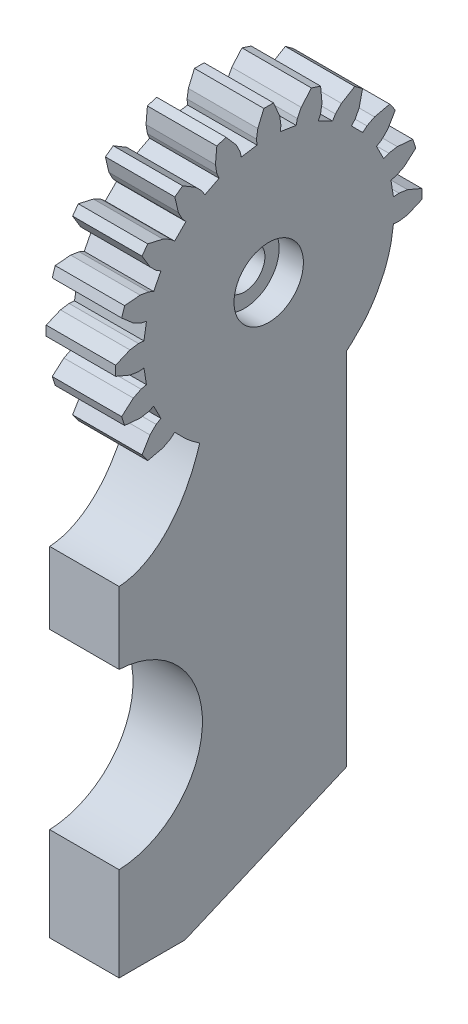
from build123d import *

# Parameters (mm, degrees)
BOSS_EXTRUDE1_DEPTH = 10
SKETCH3_R           = 2.95
CUT_EXTRUDE1_DEPTH  = 10
CUT_EXTRUDE4_DEPTH  = 10
BOSS_EXTRUDE2_DEPTH = 10
SKETCH9_R           = 5
CUT_EXTRUDE5_DEPTH  = 3.5


with BuildPart() as part:
    # Sketch1 → Boss-Extrude1 (new body)
    with BuildSketch(Plane.YZ):
        Polygon((122.8604, 156.33104), (123.6529, 156.40531), (124.8827, 156.22038), (126.9389, 155.34362), (126.9389, 153.95038), (124.8827, 153.07362), (123.6529, 152.88869), (122.8604, 152.96296), (122.5013, 150.69576), (123.278, 150.5215), (124.3904, 149.9656), (126.075, 148.49636), (125.6445, 147.1713), (123.418, 146.97285), (122.1913, 147.17699), (121.4605, 147.49252), (120.4184, 145.44725), (121.1032, 145.04152), (121.9894, 144.1691), (123.1376, 142.2512), (122.3186, 141.124), (120.1398, 141.6233), (119.0362, 142.1965), (118.4387, 142.7224), (116.8156, 141.0993), (117.3415, 140.5018), (117.9147, 139.3982), (118.414, 137.2194), (117.2868, 136.4004), (115.3689, 137.5486), (114.49648, 138.4348), (114.09075, 139.1196), (112.04548, 138.0775), (112.36101, 137.3467), (112.56515, 136.12), (112.3667, 133.8935), (111.04164, 133.463), (109.5724, 135.1476), (109.0165, 136.26), (108.84224, 137.0367), (106.57504, 136.6776), (106.64931, 135.8851), (106.46438, 134.6553), (105.58762, 132.5991), (104.19438, 132.5991), (103.31762, 134.6553), (103.13269, 135.8851), (103.20696, 136.6776), (100.93976, 137.0367), (100.7655, 136.26), (100.2096, 135.1476), (98.74036, 133.463), (97.4153, 133.8935), (97.21685, 136.12), (97.42099, 137.3467), (97.73652, 138.0775), (95.69125, 139.1196), (95.28552, 138.4348), (94.4131, 137.5486), (92.4952, 136.4004), (91.368, 137.2194), (91.8673, 139.3982), (92.4405, 140.5018), (92.9664, 141.0993), (91.3433, 142.7224), (90.7458, 142.1965), (89.6422, 141.6233), (87.4634, 141.124), (86.6444, 142.2512), (87.7926, 144.1691), (88.6788, 145.04152), (89.3636, 145.44725), (88.3215, 147.49252), (87.5907, 147.17699), (86.364, 146.97285), (84.1375, 147.1713), (83.707, 148.49636), (85.3916, 149.9656), (86.504, 150.5215), (87.2807, 150.69576), (86.9216, 152.96296), (86.1291, 152.88869), (84.8993, 153.07362), (82.8431, 153.95038), (82.8431, 155.34362), (84.8993, 156.22038), (86.1291, 156.40531), (86.9216, 156.33104), (87.2807, 158.59824), (86.504, 158.7725), (85.3916, 159.3284), (83.707, 160.79764), (84.1375, 162.1227), (86.364, 162.32115), (87.5907, 162.11701), (88.3215, 161.80148), (89.3636, 163.84675), (88.6788, 164.25248), (87.7926, 165.1249), (86.6444, 167.0428), (87.4634, 168.17), (89.6422, 167.6707), (90.7458, 167.0975), (91.3433, 166.5716), (92.9664, 168.1947), (92.4405, 168.7922), (91.8673, 169.8958), (91.368, 172.0746), (92.4952, 172.8936), (94.4131, 171.7454), (95.28552, 170.8592), (95.69125, 170.1744), (97.73652, 171.2165), (97.42099, 171.9473), (97.21685, 173.174), (97.4153, 175.4005), (98.74036, 175.831), (100.2096, 174.1464), (100.7655, 173.034), (100.93976, 172.2573), (103.20696, 172.6164), (103.13269, 173.4089), (103.31762, 174.6387), (104.19438, 176.6949), (105.58762, 176.6949), (106.46438, 174.6387), (106.64931, 173.4089), (106.57504, 172.6164), (108.84224, 172.2573), (109.0165, 173.034), (109.5724, 174.1464), (111.04164, 175.831), (112.3667, 175.4005), (112.56515, 173.174), (112.36101, 171.9473), (112.04548, 171.2165), (114.09075, 170.1744), (114.49648, 170.8592), (115.3689, 171.7454), (117.2868, 172.8936), (118.414, 172.0746), (117.9147, 169.8958), (117.3415, 168.7922), (116.8156, 168.1947), (118.4387, 166.5716), (119.0362, 167.0975), (120.1398, 167.6707), (122.3186, 168.17), (123.1376, 167.0428), (121.9894, 165.1249), (121.1032, 164.25248), (120.4184, 163.84675), (121.4605, 161.80148), (122.1913, 162.11701), (123.418, 162.32115), (125.6445, 162.1227), (126.075, 160.79764), (124.3904, 159.3284), (123.278, 158.7725), (122.5013, 158.59824), align=None)
    extrude(amount=BOSS_EXTRUDE1_DEPTH)

    # Sketch3 → Cut-Extrude1 (cut)
    with BuildSketch(Plane.YZ.offset(10)):
        with Locations(Location((104.891, 154.647, 0), (0, 0, 270))):
            Circle(SKETCH3_R)
    extrude(amount=-CUT_EXTRUDE1_DEPTH, mode=Mode.SUBTRACT)

    # Sketch5 → Cut-Extrude4 (cut)
    with BuildSketch(Plane.YZ.offset(10)):
        with BuildLine():
            Line((100.93976, 137.0367), (100.054261516, 133.090117674))
            ThreePointArc((100.054261516, 133.090117674), (83.487848916, 149.169926106), (90.294048938, 171.230794333))
            Line((90.294048938, 171.230794333), (92.9664, 168.1947))
            ThreePointArc((92.9664, 168.1947), (87.406270735, 150.172651628), (100.93976, 137.0367))
        make_face()
    extrude(amount=-CUT_EXTRUDE4_DEPTH, mode=Mode.SUBTRACT)


with BuildPart() as cut_extrude4_kept_piece:
    # of the separate pieces the step leaves, the one the design keeps (cut_extrude4_pieces_kept)
    add(part.part.solids().sort_by_distance((0, 122.8604, 156.33104))[0])

    # Sketch8 → Boss-Extrude2 (add)
    with BuildSketch(Plane(origin=(0, 0, 0), x_dir=(0, -1, 0), z_dir=(-1, 0, 0))):
        with BuildLine():
            Line((-98.898724503, 146.469883253), (-98.898724503, 143.469883253))
            Line((-98.898724503, 143.469883253), (-38.832437603, 143.469883253))
            Line((-38.832437603, 143.469883253), (-28.891, 166.6949))
            Line((-28.891, 166.6949), (-28.891, 176.1949))
            Line((-28.891, 176.1949), (-42.401004003, 176.1949))
            ThreePointArc((-42.401004003, 176.1949), (-54.891, 164.1949), (-67.380995997, 176.1949))
            Line((-67.380995997, 176.1949), (-77.731516388, 176.1949))
            add(Edge.make_bspline(
                [(-98.898724503, 163.298263053), (-78.493111017, 163.298263053), (-77.731516388, 176.1949)],
                knots=[1.570796327, 1.570796327, 1.570796327, 3.104261183, 3.104261183, 3.104261183], degree=2, weights=[1, 0.720181505, 1]))
            Line((-98.898724503, 163.298263053), (-98.898724503, 146.469883253))
        make_face()
    extrude(amount=-BOSS_EXTRUDE2_DEPTH)

    # Sketch9 → Cut-Extrude5 (cut)
    with BuildSketch(Plane.YZ.offset(10)):
        with Locations(Location((104.891, 154.647, 0), (0, 0, 270))):
            Circle(SKETCH9_R)
    extrude(amount=-CUT_EXTRUDE5_DEPTH, mode=Mode.SUBTRACT)


solid = cut_extrude4_kept_piece.part
